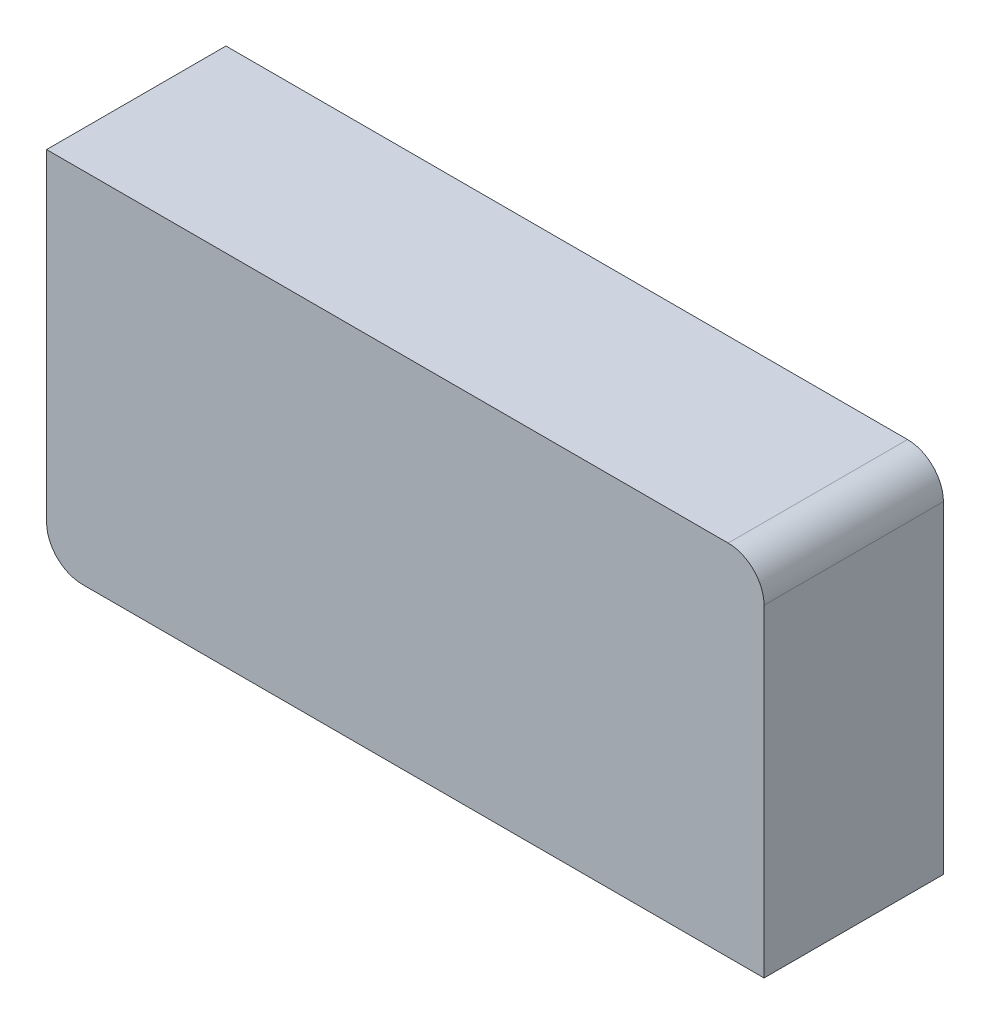
from build123d import *

# Parameters (mm, degrees)
SKETCH1_W           = 40
SKETCH1_H           = 20
BOSS_EXTRUDE1_DEPTH = 10
FILLET1_R           = 2


with BuildPart() as part:
    # Sketch1 → Boss-Extrude1 (new body)
    with BuildSketch(Plane.XY):
        with Locations((20, 10)):
            Rectangle(SKETCH1_W, SKETCH1_H)
    extrude(amount=BOSS_EXTRUDE1_DEPTH)

    # Fillet1
    fillet1_edges = [part.edges().sort_by_distance(p)[0] for p in [
        (40, 20, 5),
        (0, 0, 5),
    ]]
    fillet(fillet1_edges, radius=FILLET1_R)


solid = part.part
